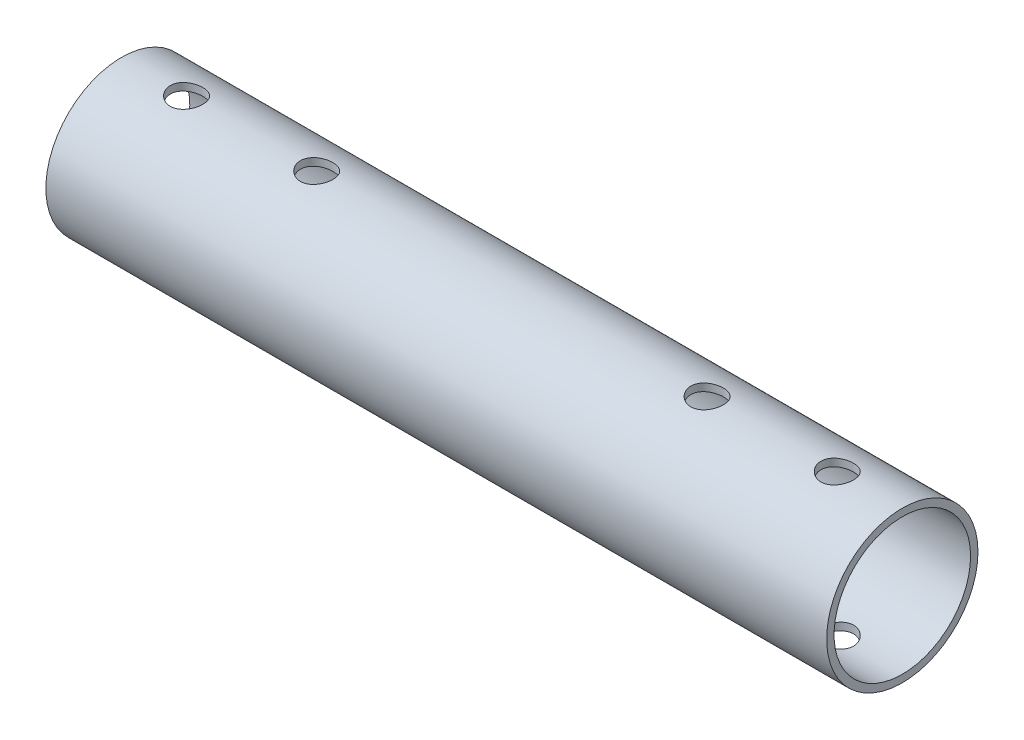
from build123d import *

# Parameters (mm, degrees)
SKETCH3_R               = 14.7701
SKETCH3_R_2             = 13.3223
BOSS_EXTRUDE1_DEPTH     = 152.4
CUT_EXTRUDE1_DEPTH      = 154.824808493
CUT_EXTRUDE1_DEPTH_BACK = 154.824808493
SKETCH4_R               = 3.175


with BuildPart() as part:
    # Sketch3 → Boss-Extrude1 (new body)
    with BuildSketch(Plane(origin=(0, 0, 0), x_dir=(0, 0, -1), z_dir=(1, 0, 0))):
        with Locations(Location((0, 0, 0), (0, 0, 180))):
            Circle(SKETCH3_R)
        with Locations(Location((0, 0, 0), (0, 0, 180))):
            Circle(SKETCH3_R_2, mode=Mode.SUBTRACT)
    extrude(amount=BOSS_EXTRUDE1_DEPTH)

    # Sketch4 → Cut-Extrude1 (cut, two sides: drawn at the far end of the back side and taken through both)
    with BuildSketch(Plane(origin=(0, 0, 0), x_dir=(1, 0, 0), z_dir=(0, 1, 0)).offset(-CUT_EXTRUDE1_DEPTH_BACK)):
        with Locations(Location((12.7, 0, 0), (0, 0, 270))):
            Circle(SKETCH4_R)
        with Locations(Location((38.1, 0, 0), (0, 0, 270))):
            Circle(SKETCH4_R)
        with Locations(Location((139.7, 0, 0), (0, 0, 270))):
            Circle(SKETCH4_R)
        with Locations(Location((114.3, 0, 0), (0, 0, 270))):
            Circle(SKETCH4_R)
    extrude(amount=CUT_EXTRUDE1_DEPTH + CUT_EXTRUDE1_DEPTH_BACK, mode=Mode.SUBTRACT)


solid = part.part
